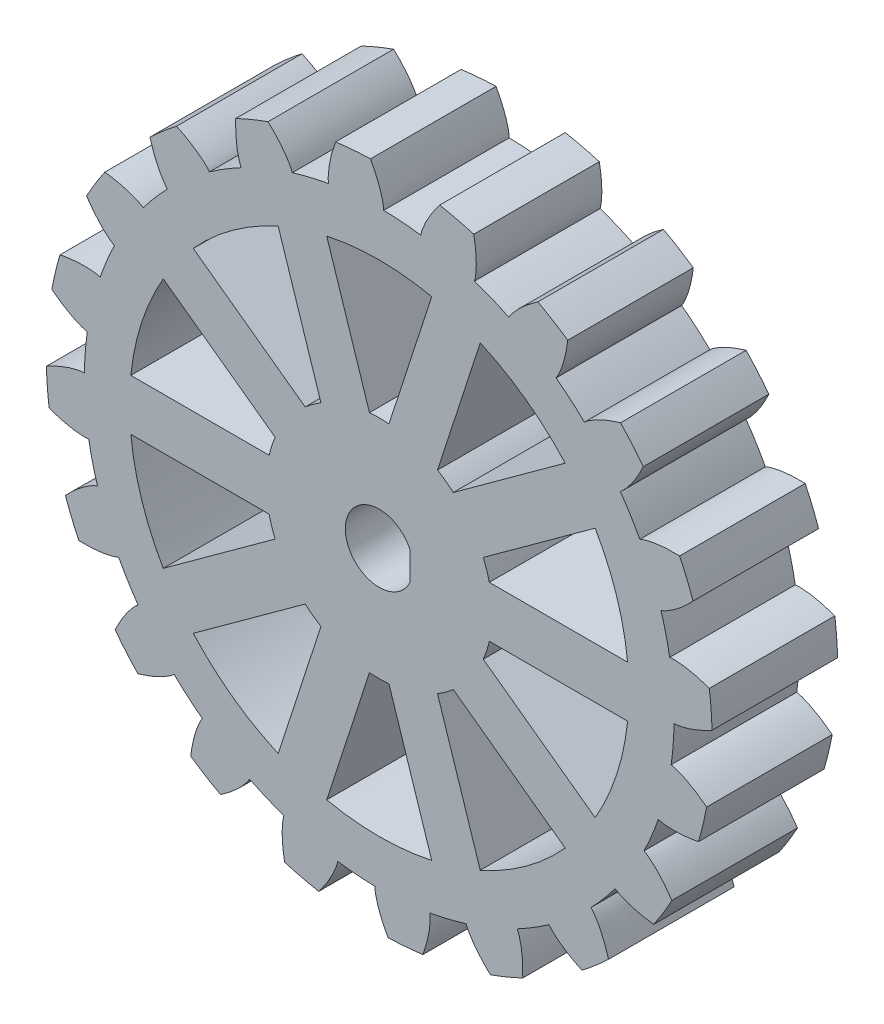
from build123d import *

# Parameters (mm, degrees)
SKETCH11_R          = 23.485
BOSS_EXTRUDE6_DEPTH = 10
BOSS_EXTRUDE7_START = -10
BOSS_EXTRUDE7_DEPTH = 10
CIRPATTERN2_COUNT   = 20
CUT_EXTRUDE2_DEPTH  = 10
CUT_EXTRUDE3_DEPTH  = 39.798369163
BOSS_EXTRUDE9_START = -10
SKETCH16_R          = 9
BOSS_EXTRUDE9_DEPTH = 20
SKETCH17_R          = 1
CUT_EXTRUDE4_DEPTH  = 20


with BuildPart() as part:
    # Sketch11 → Boss-Extrude6 (new body)
    with BuildSketch(Plane.XY):
        Circle(SKETCH11_R)
    extrude(amount=BOSS_EXTRUDE6_DEPTH)


with BuildPart() as boss_extrude7_tool:
    # Sketch12 → Boss-Extrude7 (new body)
    with BuildSketch(Plane.XY.offset(10).offset(BOSS_EXTRUDE7_START)):
        with BuildLine():
            ThreePointArc((-0.698714194, 26.507672824), (-2.092024725, 26.434226915), (-3.479543332, 26.287595901))
            add(Edge.make_bspline(
                [(-4.041867927, 23.134574756), (-4.062181435, 23.282433042), (-4.067795833, 23.589740221), (-4.031271904, 24.109524816), (-3.930902651, 24.745218006), (-3.750480819, 25.493536499), (-3.577402484, 26.021194553), (-3.479543332, 26.287595901)],
                knots=[0, 0, 0, 0, 0.099095848, 0.203819716, 0.346131534, 0.526410714, 0.715000767, 0.715000767, 0.715000767, 0.715000767], degree=3))
            ThreePointArc((-4.041867927, 23.134574756), (-1.852827397, 23.411797798), (0.352568917, 23.482353814))
            add(Edge.make_bspline(
                [(0.352568917, 23.482353814), (0.349371987, 23.631566719), (0.306578203, 23.935931493), (0.188748737, 24.443500444), (-0.010363268, 25.05549246), (-0.306246859, 25.766115782), (-0.560169293, 26.259980671), (-0.698714194, 26.507672824)],
                knots=[0, 0, 0, 0, 0.099095848, 0.203819716, 0.346131534, 0.526410714, 0.715000767, 0.715000767, 0.715000767, 0.715000767], degree=3))
        make_face()
    boss_extrude7 = extrude(amount=BOSS_EXTRUDE7_DEPTH)


with BuildPart() as part_1:
    add(part.part)


with BuildPart() as part_2:
    # Boss-Extrude7: joined with boss_extrude7_tool
    add(part_1.part.fuse(boss_extrude7_tool.part, tol=0.00001))

    # CirPattern2: Boss-Extrude7 ×20 about axis
    cirpattern2_axis = Axis((0, 0, 0), (0, 0, -1))
    for i in range(1, CIRPATTERN2_COUNT):
        add(boss_extrude7.rotate(cirpattern2_axis, i * 360 / CIRPATTERN2_COUNT))

    # Sketch13 → Cut-Extrude2 (cut)
    with BuildSketch(Plane.XY.offset(10)):
        with BuildLine():
            Line((2.45, 1.134680572), (2.45, -1.134680572))
            ThreePointArc((2.45, -1.134680572), (-2.7, 0), (2.45, 1.134680572))
        make_face()
    extrude(amount=-CUT_EXTRUDE2_DEPTH, mode=Mode.SUBTRACT)

    # Sketch14 → Cut-Extrude3 (cut, through all)
    with BuildSketch(Plane(origin=(0, 0, 0), x_dir=(-1, 0, 0), z_dir=(0, 0, -1))):
        with BuildLine():
            Line((-7.360141242, 2.836457816), (-17.199451215, 9.985134958))
            ThreePointArc((-17.199451215, 9.985134958), (-18.914408715, 6.145663934), (-19.783763397, 2.0314399))
            Line((-19.783763397, 2.0314399), (-7.621707419, 2.0314399))
            ThreePointArc((-7.621707419, 2.0314399), (-7.501730519, 2.437460002), (-7.360141242, 2.836457816))
        make_face()
        with BuildLine():
            Line((-7.621707419, -2.0314399), (-19.783763397, -2.0314399))
            ThreePointArc((-19.783763397, -2.0314399), (-18.914408715, -6.145663934), (-17.199451215, -9.985134958))
            Line((-17.199451215, -9.985134958), (-7.360141242, -2.836457816))
            ThreePointArc((-7.360141242, -2.836457816), (-7.501730519, -2.437460002), (-7.621707419, -2.0314399))
        make_face()
        with BuildLine():
            Line((-4.972040414, 6.12339662), (-14.811350387, 13.272073762))
            ThreePointArc((-14.811350387, 13.272073762), (-11.689747463, 16.089557063), (-8.045533257, 18.187727644))
            Line((-8.045533257, 18.187727644), (-4.287251273, 6.620925054))
            ThreePointArc((-4.287251273, 6.620925054), (-4.636324435, 6.38135313), (-4.972040414, 6.12339662))
        make_face()
        with BuildLine():
            Line((-0.423222965, 7.876423958), (-4.181504948, 19.443226548))
            ThreePointArc((-4.181504948, 19.443226548), (0, 19.887786258), (4.181504948, 19.443226548))
            Line((4.181504948, 19.443226548), (0.423222965, 7.876423958))
            ThreePointArc((0.423222965, 7.876423958), (0, 7.887786258), (-0.423222965, 7.876423958))
        make_face()
        with BuildLine():
            Line((4.287251273, 6.620925054), (8.045533257, 18.187727644))
            ThreePointArc((8.045533257, 18.187727644), (11.689747463, 16.089557063), (14.811350387, 13.272073762))
            Line((14.811350387, 13.272073762), (4.972040414, 6.12339662))
            ThreePointArc((4.972040414, 6.12339662), (4.636324435, 6.38135313), (4.287251273, 6.620925054))
        make_face()
        with BuildLine():
            Line((7.360141242, 2.836457816), (17.199451215, 9.985134958))
            ThreePointArc((17.199451215, 9.985134958), (18.914408715, 6.145663934), (19.783763397, 2.0314399))
            Line((19.783763397, 2.0314399), (7.621707419, 2.0314399))
            ThreePointArc((7.621707419, 2.0314399), (7.501730519, 2.437460002), (7.360141242, 2.836457816))
        make_face()
        with BuildLine():
            Line((7.621707419, -2.0314399), (19.783763397, -2.0314399))
            ThreePointArc((19.783763397, -2.0314399), (18.914408715, -6.145663934), (17.199451215, -9.985134958))
            Line((17.199451215, -9.985134958), (7.360141242, -2.836457816))
            ThreePointArc((7.360141242, -2.836457816), (7.501730519, -2.437460002), (7.621707419, -2.0314399))
        make_face()
        with BuildLine():
            Line((4.972040414, -6.12339662), (14.811350387, -13.272073762))
            ThreePointArc((14.811350387, -13.272073762), (11.689747463, -16.089557063), (8.045533257, -18.187727644))
            Line((8.045533257, -18.187727644), (4.287251273, -6.620925054))
            ThreePointArc((4.287251273, -6.620925054), (4.636324435, -6.38135313), (4.972040414, -6.12339662))
        make_face()
        with BuildLine():
            Line((0.423222965, -7.876423958), (4.181504948, -19.443226548))
            ThreePointArc((4.181504948, -19.443226548), (0, -19.887786258), (-4.181504948, -19.443226548))
            Line((-4.181504948, -19.443226548), (-0.423222965, -7.876423958))
            ThreePointArc((-0.423222965, -7.876423958), (0, -7.887786258), (0.423222965, -7.876423958))
        make_face()
        with BuildLine():
            Line((-4.287251273, -6.620925054), (-8.045533257, -18.187727644))
            ThreePointArc((-8.045533257, -18.187727644), (-11.689747463, -16.089557063), (-14.811350387, -13.272073762))
            Line((-14.811350387, -13.272073762), (-4.972040414, -6.12339662))
            ThreePointArc((-4.972040414, -6.12339662), (-4.636324435, -6.38135313), (-4.287251273, -6.620925054))
        make_face()
    extrude(amount=-CUT_EXTRUDE3_DEPTH, mode=Mode.SUBTRACT)

    # Sketch16 → Boss-Extrude9 (add)
    with BuildSketch(Plane(origin=(0, 0, 0), x_dir=(-1, 0, 0), z_dir=(0, 0, -1)).offset(BOSS_EXTRUDE9_START)):
        Circle(SKETCH16_R)
        with BuildLine():
            Line((-2.45, -1.134680572), (-2.45, 1.134680572))
            ThreePointArc((-2.45, 1.134680572), (2.7, 0), (-2.45, -1.134680572))
        make_face(mode=Mode.SUBTRACT)
    extrude(amount=BOSS_EXTRUDE9_DEPTH)

    # Sketch17 → Cut-Extrude4 (cut)
    with BuildSketch(Plane.ZY.offset(-2.45)):
        with Locations((-5, 0)):
            Circle(SKETCH17_R)
    extrude(amount=-CUT_EXTRUDE4_DEPTH, mode=Mode.SUBTRACT)


solid = part_2.part
